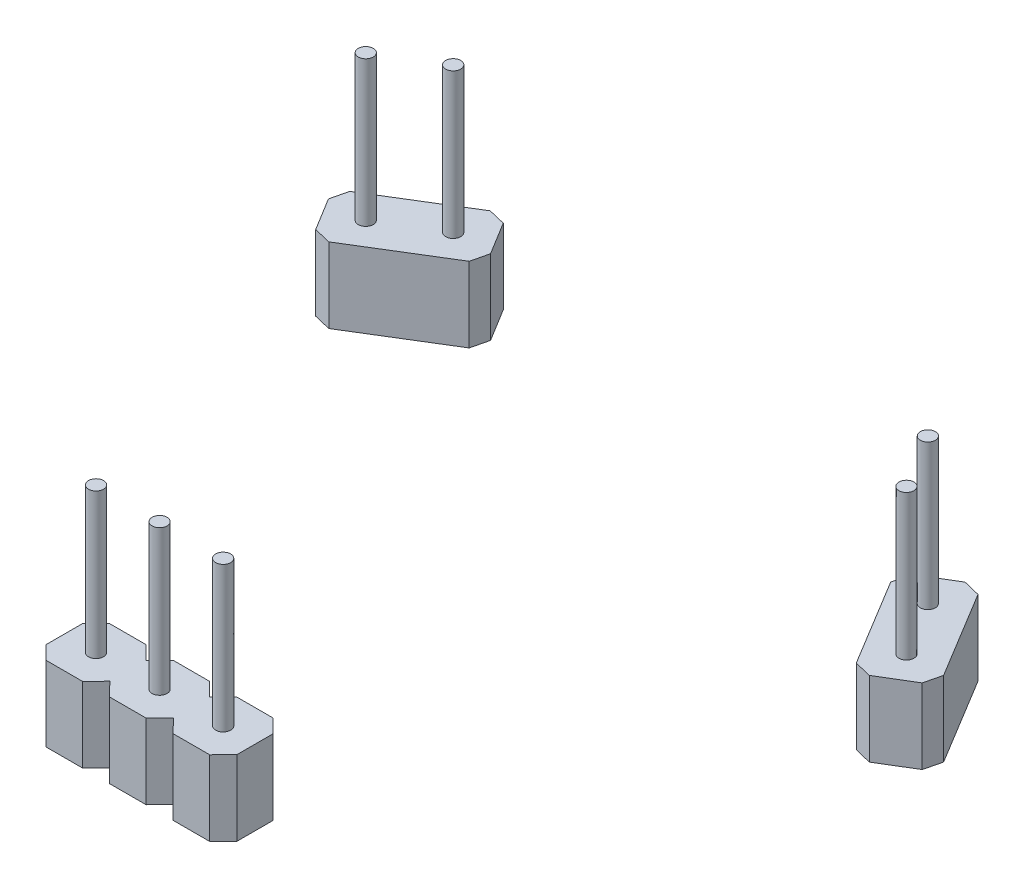
from build123d import *

# Parameters (mm, degrees)
EXTRUDE_1_DEPTH   = 3
EXTRUDE_1_2_DEPTH = 3
EXTRUDE_1_3_DEPTH = 3
CHAMFER_1_SIZE    = 0.5
CHAMFER_2_SIZE    = 0.5
SKETCH_2_R        = 0.3
EXTRUDE_2_DEPTH   = 5.8


with BuildPart() as part:
    # 草图1 → 凸台-拉伸1 (new body)
    with BuildSketch(Plane(origin=(0, 3.5, 0), x_dir=(1, 0, 0), z_dir=(0, 1, 0))):
        Polygon((-3.81, -14.42), (-3.27, -14.97), (-1.81, -14.97), (-1.27, -14.42), (-0.73, -14.97), (0.73, -14.97), (1.27, -14.42), (1.81, -14.97), (3.27, -14.97), (3.81, -14.42), (3.81, -12.98), (3.27, -12.43), (1.81, -12.43), (1.27, -12.98), (0.73, -12.43), (-0.73, -12.43), (-1.27, -12.98), (-1.81, -12.43), (-3.27, -12.43), (-3.81, -12.98), align=None)
    extrude(amount=-EXTRUDE_1_DEPTH)



with BuildPart() as body_2:
    # 草图1 → Extrude 1 2 (new body)
    with BuildSketch(Plane(origin=(0, 3.5, 0), x_dir=(1, 0, 0), z_dir=(0, 1, 0))):
        Polygon((-9.52353721, 9.720015629), (-13.853921534, 7.064046576), (-12.525937008, 4.898854414), (-8.195552684, 7.554823466), align=None)
    extrude(amount=-EXTRUDE_1_2_DEPTH)

    # 倒角1
    chamfer_1_edges = [body_2.edges().sort_by_distance(p)[0] for p in [
        (-13.853921534, 2, -7.064046576),
        (-12.525937008, 2, -4.898854414),
        (-8.195552684, 2, -7.554823466),
        (-9.52353721, 2, -9.720015629),
    ]]
    chamfer(chamfer_1_edges, length=CHAMFER_1_SIZE)


with BuildPart() as body_3:
    # 草图1 → Extrude 1 3 (new body)
    with BuildSketch(Plane(origin=(0, 3.5, 0), x_dir=(1, 0, 0), z_dir=(0, 1, 0))):
        Polygon((10.641496985, 5.04080908), (12.813807939, 6.357116461), (15.446422701, 2.012494554), (13.274111747, 0.696187173), align=None)
    extrude(amount=-EXTRUDE_1_3_DEPTH)

    # 倒角2
    chamfer_2_edges = [body_3.edges().sort_by_distance(p)[0] for p in [
        (10.641496985, 2, -5.04080908),
        (13.274111747, 2, -0.696187173),
        (15.446422701, 2, -2.012494554),
        (12.813807939, 2, -6.357116461),
    ]]
    chamfer(chamfer_2_edges, length=CHAMFER_2_SIZE)


with BuildPart() as part_1:
    add(part.part)

    add(body_2.part)  # 凸台-拉伸2 merges body 2

    add(body_3.part)  # 凸台-拉伸2 merges body 3
    # 草图2 → 凸台-拉伸2 (add)
    with BuildSketch(Plane(origin=(0, 3.5, 0), x_dir=(1, 0, 0), z_dir=(0, 1, 0))):
        with Locations(Location((-12.10733319, 6.645442758, 0), (0, 0, 270))):
            Circle(SKETCH_2_R)
        with Locations(Location((-9.942141028, 7.973427284, 0), (0, 0, 270))):
            Circle(SKETCH_2_R)
        with Locations(Location((12.385806153, 4.612807294, 0), (0, 0, 270))):
            Circle(SKETCH_2_R)
        with Locations(Location((13.702113533, 2.44049634, 0), (0, 0, 270))):
            Circle(SKETCH_2_R)
        with Locations(Location((0, -13.7, 0), (0, 0, 270))):
            Circle(SKETCH_2_R)
        with Locations(Location((-2.54, -13.7, 0), (0, 0, 270))):
            Circle(SKETCH_2_R)
        with Locations(Location((2.54, -13.7, 0), (0, 0, 270))):
            Circle(SKETCH_2_R)
    extrude(amount=EXTRUDE_2_DEPTH)


solid = part_1.part
